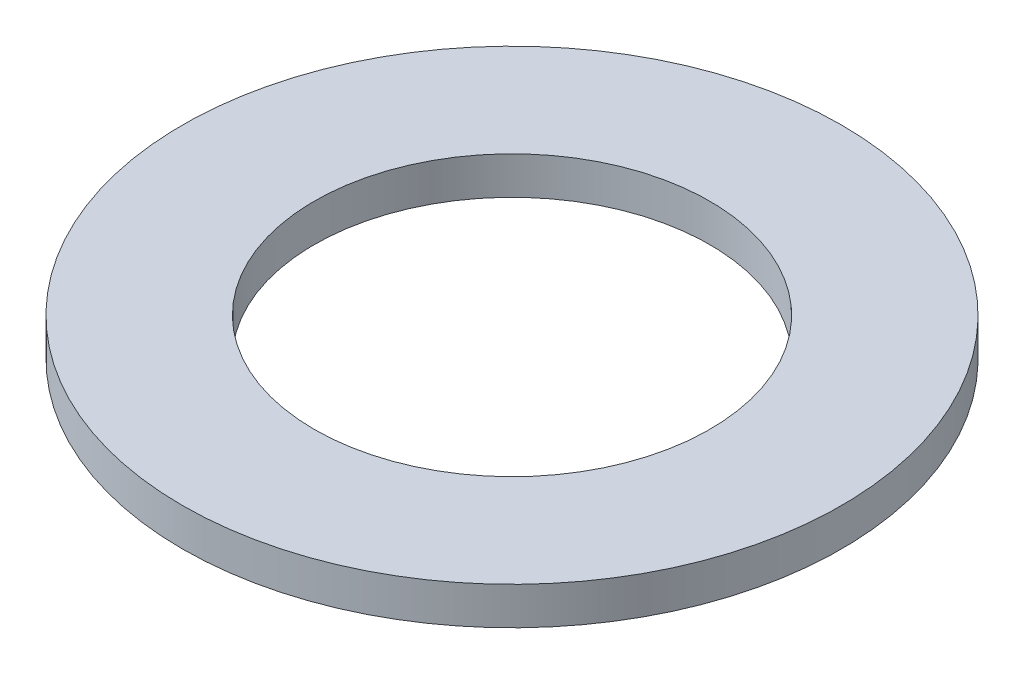
from build123d import *

# Parameters (mm, degrees)
SZKIC1_R                    = 17.5
SZKIC1_R_2                  = 10.5
DODANIE_WYCI_GNI_CIE1_DEPTH = 2


with BuildPart() as part:
    # Szkic1 → Dodanie-wyciągnięcie1 (new body)
    with BuildSketch(Plane(origin=(0, 0, 0), x_dir=(1, 0, 0), z_dir=(0, 1, 0))):
        with Locations(Location((0, 0, 0), (0, 0, 270))):
            Circle(SZKIC1_R)
        with Locations(Location((0, 0, 0), (0, 0, 270))):
            Circle(SZKIC1_R_2, mode=Mode.SUBTRACT)
    extrude(amount=DODANIE_WYCI_GNI_CIE1_DEPTH)


solid = part.part
